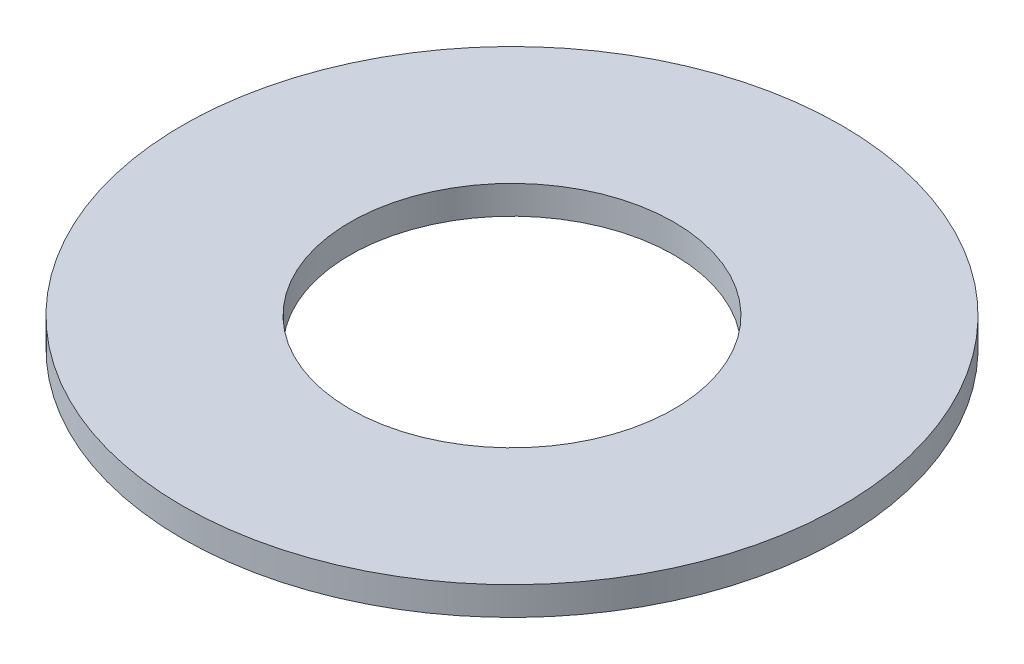
from build123d import *

# Parameters (mm, degrees)
SKETCH1_R           = 5.8
SKETCH1_R_2         = 2.85
BOSS_EXTRUDE2_DEPTH = 0.5


with BuildPart() as part:
    # Sketch1 → Boss-Extrude2 (new body)
    with BuildSketch(Plane(origin=(0, 0, 0), x_dir=(1, 0, 0), z_dir=(0, 1, 0))):
        with Locations(Location((0, 0, 0), (0, 0, 270))):
            Circle(SKETCH1_R)
        with Locations(Location((0, 0, 0), (0, 0, 270))):
            Circle(SKETCH1_R_2, mode=Mode.SUBTRACT)
    extrude(amount=BOSS_EXTRUDE2_DEPTH)


solid = part.part
